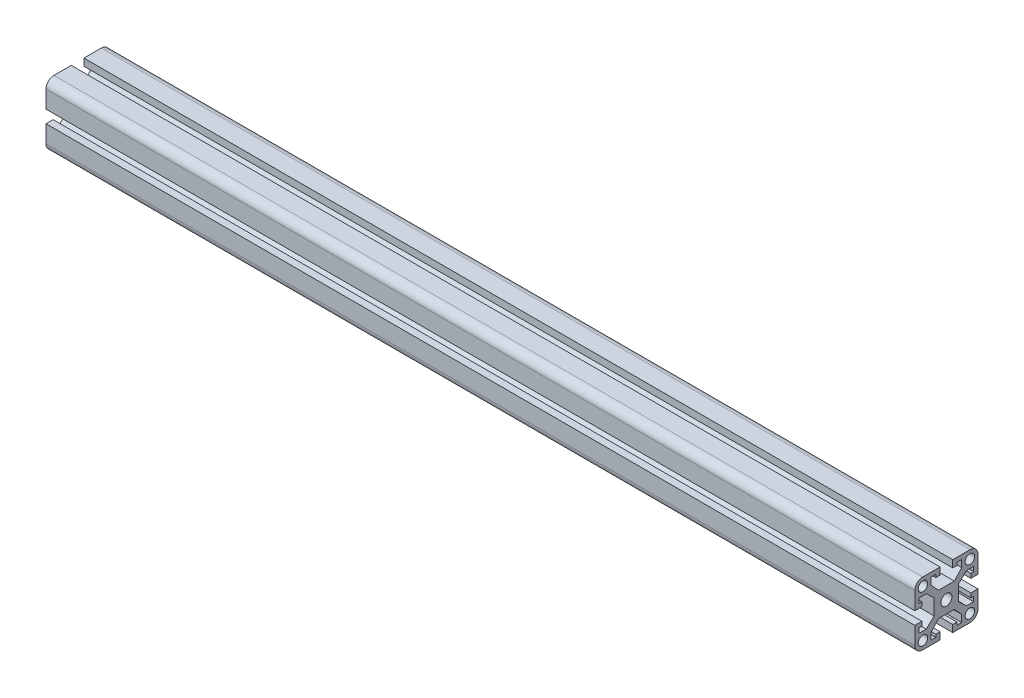
from build123d import *

# Parameters (mm, degrees)
SKETCH_1_W          = 40
SKETCH_1_H          = 40
EXTRUDE_1_DEPTH     = 550
CUT_EXTRUDE_1_REACH = 558.07
SKETCH_2_R          = 3.5
SKETCH_2_R_2        = 3
FILLET_1_R          = 5


with BuildPart() as part:
    # 草图1 → 凸台-拉伸1 (new body)
    with BuildSketch(Plane(origin=(0, 0, 0), x_dir=(0, 0, -1), z_dir=(1, 0, 0))):
        with Locations((40.704960836, 35.035758607)):
            Rectangle(SKETCH_1_W, SKETCH_1_H)
    extrude(amount=EXTRUDE_1_DEPTH)

    # 草图2 → 切除-拉伸1 (cut, up to next)
    with BuildSketch(Plane(origin=(550, 0, 0), x_dir=(0, 0, -1), z_dir=(1, 0, 0)), mode=Mode.PRIVATE) as cut_extrude_1_sk1:
        with Locations((40.704960836, 35.035758607)):
            Circle(SKETCH_2_R)
    cut_extrude_1_tool1 = extrude(cut_extrude_1_sk1.sketch, amount=-CUT_EXTRUDE_1_REACH, mode=Mode.PRIVATE) & part.part
    # 草图2 → 切除-拉伸1 (cut, up to next)
    with BuildSketch(Plane(origin=(550, 0, 0), x_dir=(0, 0, -1), z_dir=(1, 0, 0)), mode=Mode.PRIVATE) as cut_extrude_1_sk2:
        with Locations((25.854960836, 49.885758607)):
            Circle(SKETCH_2_R_2)
    cut_extrude_1_tool2 = extrude(cut_extrude_1_sk2.sketch, amount=-CUT_EXTRUDE_1_REACH, mode=Mode.PRIVATE) & part.part
    # 草图2 → 切除-拉伸1 (cut, up to next)
    with BuildSketch(Plane(origin=(550, 0, 0), x_dir=(0, 0, -1), z_dir=(1, 0, 0)), mode=Mode.PRIVATE) as cut_extrude_1_sk3:
        with Locations((25.854960836, 20.185758607)):
            Circle(SKETCH_2_R_2)
    cut_extrude_1_tool3 = extrude(cut_extrude_1_sk3.sketch, amount=-CUT_EXTRUDE_1_REACH, mode=Mode.PRIVATE) & part.part
    # 草图2 → 切除-拉伸1 (cut, up to next)
    with BuildSketch(Plane(origin=(550, 0, 0), x_dir=(0, 0, -1), z_dir=(1, 0, 0)), mode=Mode.PRIVATE) as cut_extrude_1_sk4:
        with Locations((55.554960836, 49.885758607)):
            Circle(SKETCH_2_R_2)
    cut_extrude_1_tool4 = extrude(cut_extrude_1_sk4.sketch, amount=-CUT_EXTRUDE_1_REACH, mode=Mode.PRIVATE) & part.part
    # 草图2 → 切除-拉伸1 (cut, up to next)
    with BuildSketch(Plane(origin=(550, 0, 0), x_dir=(0, 0, -1), z_dir=(1, 0, 0)), mode=Mode.PRIVATE) as cut_extrude_1_sk5:
        with Locations((55.554960836, 20.185758607)):
            Circle(SKETCH_2_R_2)
    cut_extrude_1_tool5 = extrude(cut_extrude_1_sk5.sketch, amount=-CUT_EXTRUDE_1_REACH, mode=Mode.PRIVATE) & part.part
    # 草图2 → 切除-拉伸1 (cut, up to next)
    with BuildSketch(Plane(origin=(550, 0, 0), x_dir=(0, 0, -1), z_dir=(1, 0, 0)), mode=Mode.PRIVATE) as cut_extrude_1_sk6:
        Polygon((36.704960836, 15.035758607), (36.704960836, 19.535758607), (34.004960836, 19.535758607), (34.004960836, 17.735758607), (31.004960836, 17.735758607), (31.004960836, 22.235758607), (35.704960836, 27.275758607), (45.704960836, 27.275758607), (50.404960836, 22.235758607), (50.404960836, 17.735758607), (47.404960836, 17.735758607), (47.404960836, 19.535758607), (44.704960836, 19.535758607), (44.704960836, 15.035758607), align=None)
    cut_extrude_1_tool6 = extrude(cut_extrude_1_sk6.sketch, amount=-CUT_EXTRUDE_1_REACH, mode=Mode.PRIVATE) & part.part
    # 草图2 → 切除-拉伸1 (cut, up to next)
    with BuildSketch(Plane(origin=(550, 0, 0), x_dir=(0, 0, -1), z_dir=(1, 0, 0)), mode=Mode.PRIVATE) as cut_extrude_1_sk7:
        Polygon((44.704960836, 55.035758607), (44.704960836, 50.535758607), (47.404960836, 50.535758607), (47.404960836, 52.335758607), (50.404960836, 52.335758607), (50.404960836, 47.835758607), (45.704960836, 42.795758607), (35.704960836, 42.795758607), (31.004960836, 47.835758607), (31.004960836, 52.335758607), (34.004960836, 52.335758607), (34.004960836, 50.535758607), (36.704960836, 50.535758607), (36.704960836, 55.035758607), align=None)
    cut_extrude_1_tool7 = extrude(cut_extrude_1_sk7.sketch, amount=-CUT_EXTRUDE_1_REACH, mode=Mode.PRIVATE) & part.part
    # 草图2 → 切除-拉伸1 (cut, up to next)
    with BuildSketch(Plane(origin=(550, 0, 0), x_dir=(0, 0, -1), z_dir=(1, 0, 0)), mode=Mode.PRIVATE) as cut_extrude_1_sk8:
        Polygon((20.704960836, 31.035758607), (20.704960836, 39.035758607), (25.204960836, 39.035758607), (25.204960836, 41.735758607), (23.404960836, 41.735758607), (23.404960836, 44.735758607), (27.954960836, 44.735758607), (32.944960836, 40.035758607), (32.944960836, 30.035758607), (27.954960836, 25.335758607), (23.404960836, 25.335758607), (23.404960836, 28.335758607), (25.204960836, 28.335758607), (25.204960836, 31.035758607), align=None)
    cut_extrude_1_tool8 = extrude(cut_extrude_1_sk8.sketch, amount=-CUT_EXTRUDE_1_REACH, mode=Mode.PRIVATE) & part.part
    # 草图2 → 切除-拉伸1 (cut, up to next)
    with BuildSketch(Plane(origin=(550, 0, 0), x_dir=(0, 0, -1), z_dir=(1, 0, 0)), mode=Mode.PRIVATE) as cut_extrude_1_sk9:
        Polygon((60.704960836, 31.035758607), (56.204960836, 31.035758607), (56.204960836, 28.335758607), (58.004960836, 28.335758607), (58.004960836, 25.335758607), (53.454960836, 25.335758607), (48.464960836, 30.035758607), (48.464960836, 40.035758607), (53.454960836, 44.735758607), (58.004960836, 44.735758607), (58.004960836, 41.735758607), (56.204960836, 41.735758607), (56.204960836, 39.035758607), (60.704960836, 39.035758607), align=None)
    cut_extrude_1_tool9 = extrude(cut_extrude_1_sk9.sketch, amount=-CUT_EXTRUDE_1_REACH, mode=Mode.PRIVATE) & part.part
    add(cut_extrude_1_tool1.solids().sort_by_distance((550, 35.035759, -40.704961))[0], mode=Mode.SUBTRACT)
    add(cut_extrude_1_tool2.solids().sort_by_distance((550, 49.885759, -25.854961))[0], mode=Mode.SUBTRACT)
    add(cut_extrude_1_tool3.solids().sort_by_distance((550, 20.185759, -25.854961))[0], mode=Mode.SUBTRACT)
    add(cut_extrude_1_tool4.solids().sort_by_distance((550, 49.885759, -55.554961))[0], mode=Mode.SUBTRACT)
    add(cut_extrude_1_tool5.solids().sort_by_distance((550, 20.185759, -55.554961))[0], mode=Mode.SUBTRACT)
    add(cut_extrude_1_tool6.solids().sort_by_distance((550, 21.537481, -40.704961))[0], mode=Mode.SUBTRACT)
    add(cut_extrude_1_tool7.solids().sort_by_distance((550, 48.534036, -40.704961))[0], mode=Mode.SUBTRACT)
    add(cut_extrude_1_tool8.solids().sort_by_distance((550, 35.035759, -27.209927))[0], mode=Mode.SUBTRACT)
    add(cut_extrude_1_tool9.solids().sort_by_distance((550, 35.035759, -54.199995))[0], mode=Mode.SUBTRACT)

    # 圆角1
    fillet_1_edges = [part.edges().sort_by_distance(p)[0] for p in [
        (275, 55.035758607, -20.704960836),
        (275, 55.035758607, -60.704960836),
        (275, 15.035758607, -60.704960836),
        (275, 15.035758607, -20.704960836),
    ]]
    fillet(fillet_1_edges, radius=FILLET_1_R)


solid = part.part
